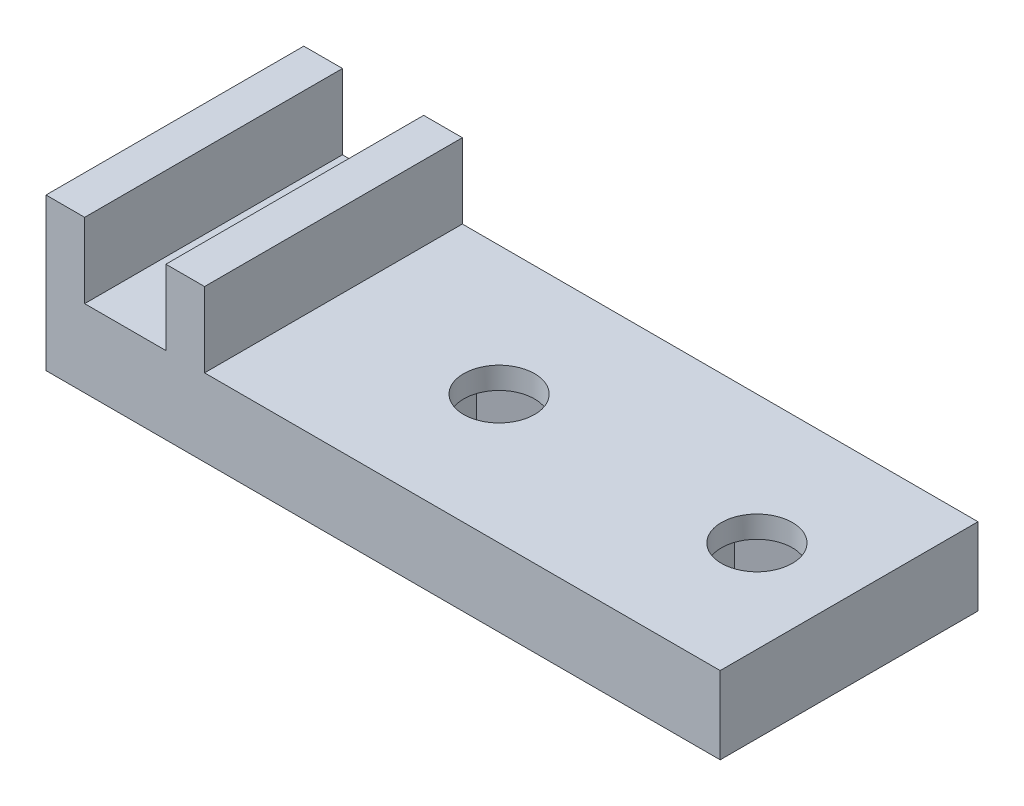
from build123d import *

# Parameters (mm, degrees)
EXTRUDE_20_DEPTH         = 20
CUT_EXTRUDE_5_DEPTH      = 54.401521514
CUT_EXTRUDE_5_DEPTH_BACK = 54.401521514
SKETCH_5_R               = 2.75
CUT_EXTRUDE_5_4_3_DEPTH  = 4.3


with BuildPart() as part:
    # Профиль_скобы_6мм → Печатный_корпус_20мм (new body)
    with BuildSketch(Plane.XY):
        Polygon((-3.15, -6), (49.15, -6), (49.15, 0), (9.15, 0), (9.15, 5.8), (6.15, 5.8), (6.15, 0), (-0.15, 0), (-0.15, 5.8), (-3.15, 5.8), align=None)
    extrude(amount=EXTRUDE_20_DEPTH)

    # Sketch 5 → Винты_полки_М5 (cut, two sides: drawn at the far end of the back side and taken through both)
    with BuildSketch(Plane(origin=(0, 0, 0), x_dir=(1, 0, 0), z_dir=(0, 1, 0)).offset(-CUT_EXTRUDE_5_DEPTH_BACK)):
        with Locations(Location((22, -10, 0), (0, 0, 270))):
            Circle(SKETCH_5_R)
        with Locations(Location((42, -10, 0), (0, 0, 270))):
            Circle(SKETCH_5_R)
    extrude(amount=CUT_EXTRUDE_5_DEPTH + CUT_EXTRUDE_5_DEPTH_BACK, mode=Mode.SUBTRACT)

    # Sketch 5 2 → Гайки_полки_М5_4_3мм (cut)
    with BuildSketch(Plane.XZ.offset(6)):
        Polygon((22, 14.792007234), (26.15, 12.396003617), (26.15, 7.603996383), (22, 5.207992766), (17.85, 7.603996383), (17.85, 12.396003617), align=None)
        Polygon((42, 14.792007234), (46.15, 12.396003617), (46.15, 7.603996383), (42, 5.207992766), (37.85, 7.603996383), (37.85, 12.396003617), align=None)
    extrude(amount=-CUT_EXTRUDE_5_4_3_DEPTH, mode=Mode.SUBTRACT)


solid = part.part
